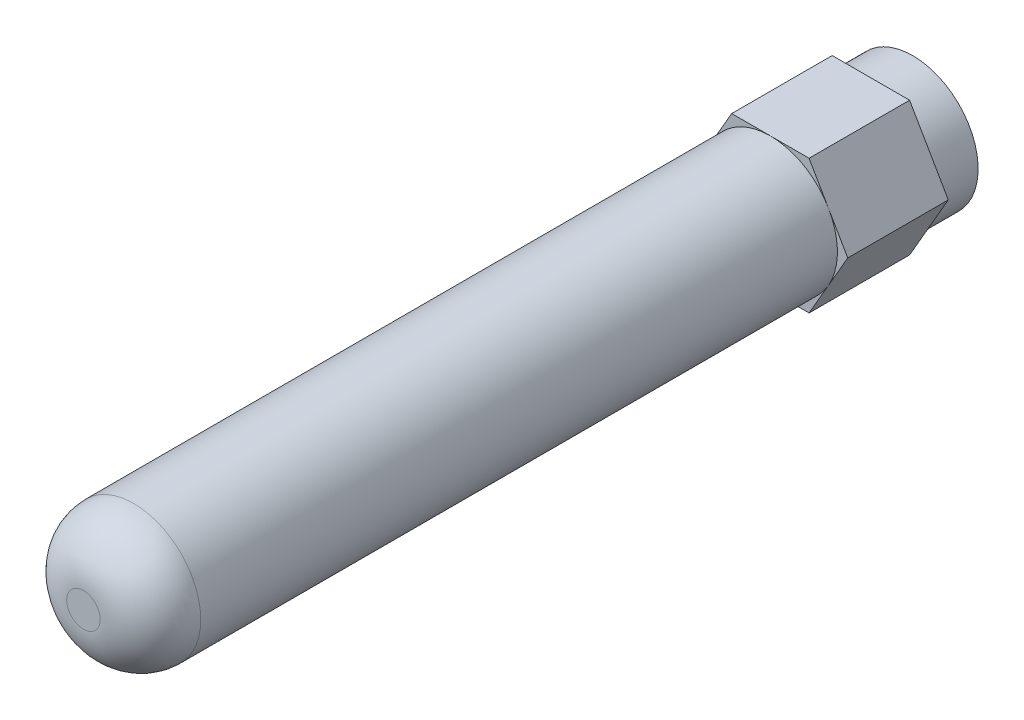
from build123d import *

# Parameters (mm, degrees)
CROQUIS1_R              = 4
SALIENTE_EXTRUIR1_DEPTH = 41
SALIENTE_EXTRUIR2_DEPTH = 6
CROQUIS3_R              = 3.9
SALIENTE_EXTRUIR3_DEPTH = 2.5
REDONDEO1_R             = 3


with BuildPart() as part:
    # Croquis1 → Saliente-Extruir1 (new body)
    with BuildSketch(Plane.XY):
        Circle(CROQUIS1_R)
    extrude(amount=SALIENTE_EXTRUIR1_DEPTH)

    # Croquis2 → Saliente-Extruir2 (add)
    with BuildSketch(Plane(origin=(0, 0, 0), x_dir=(-1, 0, 0), z_dir=(0, 0, -1))):
        Polygon((-2.309401077, 4), (-4.618802154, 0), (-2.309401077, -4), (2.309401077, -4), (4.618802154, 0), (2.309401077, 4), align=None)
    extrude(amount=SALIENTE_EXTRUIR2_DEPTH)

    # Croquis3 → Saliente-Extruir3 (add)
    with BuildSketch(Plane(origin=(0, 0, -6), x_dir=(-1, 0, 0), z_dir=(0, 0, -1))):
        Circle(CROQUIS3_R)
    extrude(amount=SALIENTE_EXTRUIR3_DEPTH)

    # Redondeo1
    redondeo1_edges = [part.edges().sort_by_distance(p)[0] for p in [
        (-4, 0, 41),
    ]]
    fillet(redondeo1_edges, radius=REDONDEO1_R)


solid = part.part
